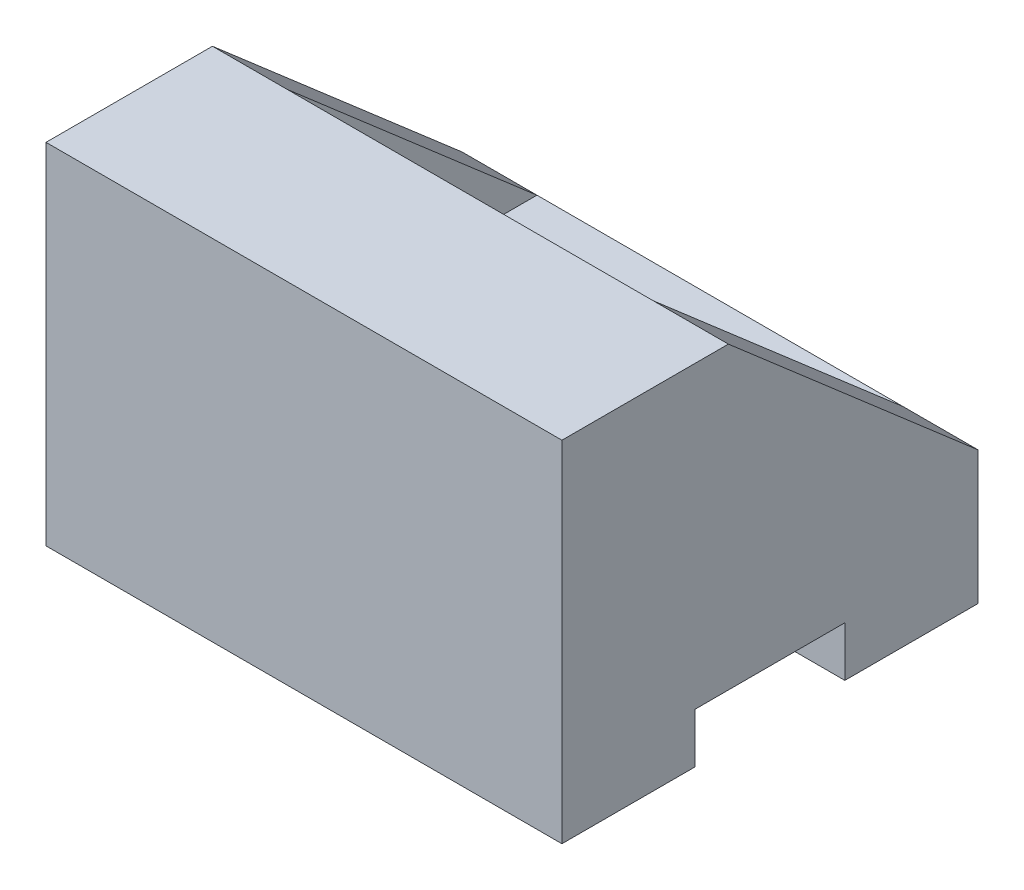
from build123d import *

# Parameters (mm, degrees)
BOSS_EXTRUDE1_DEPTH = 31
BOSS_EXTRUDE2_START = 22
BOSS_EXTRUDE2_DEPTH = 9
BOSS_EXTRUDE4_START = -22
BOSS_EXTRUDE4_DEPTH = 9


with BuildPart() as part:
    # Sketch1 → Boss-Extrude1 (new, symmetric)
    with BuildSketch(Plane(origin=(0, 0, 0), x_dir=(0, 0, -1), z_dir=(1, 0, 0))):
        Polygon((-13.203112203, 20.060606061), (-33.203112203, 20.060606061), (-33.203112203, -21.939393939), (-17.203112203, -21.939393939), (-17.203112203, -15.939393939), (0.796887797, -15.939393939), (0.796887797, -21.939393939), (16.796887797, -21.939393939), (16.796887797, -5.939393939), (-13.203112203, -5.939393939), align=None)
    extrude(amount=BOSS_EXTRUDE1_DEPTH, both=True)

    # Sketch1<4> → Boss-Extrude2 (add)
    with BuildSketch(Plane(origin=(0, 0, 0), x_dir=(0, 0, -1), z_dir=(1, 0, 0)).offset(BOSS_EXTRUDE2_START)):
        Polygon((16.796887797, -5.939393939), (-13.203112203, 20.060606061), (-13.203112203, -5.939393939), align=None)
    extrude(amount=BOSS_EXTRUDE2_DEPTH)

    # Sketch1<14> → Boss-Extrude4 (add)
    with BuildSketch(Plane(origin=(0, 0, 0), x_dir=(0, 0, -1), z_dir=(1, 0, 0)).offset(BOSS_EXTRUDE4_START)):
        Polygon((16.796887797, -5.939393939), (-13.203112203, 20.060606061), (-13.203112203, -5.939393939), align=None)
    extrude(amount=-BOSS_EXTRUDE4_DEPTH)


solid = part.part
